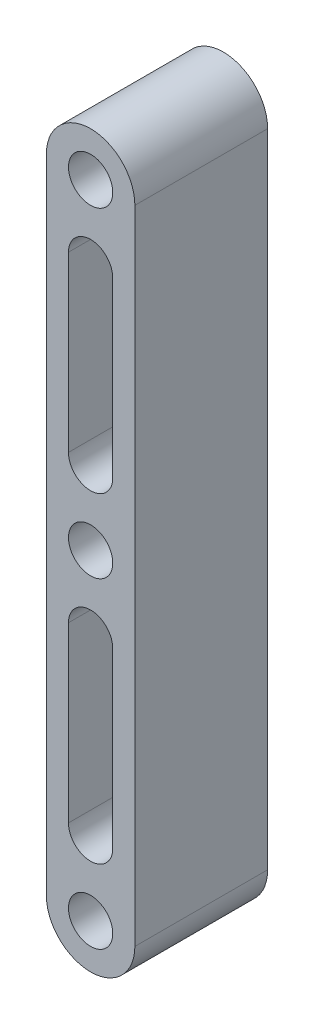
from build123d import *

# Parameters (mm, degrees)
SKETCH1_R           = 3
BOSS_EXTRUDE1_DEPTH = 9


with BuildPart() as part:
    # Sketch1 → Boss-Extrude1 (new, symmetric)
    with BuildSketch(Plane.XY):
        with BuildLine():
            Line((6, 0), (6, -87))
            ThreePointArc((6, -87), (0, -93), (-6, -87))
            Line((-6, -87), (-6, 0))
            ThreePointArc((-6, 0), (0, 6), (6, 0))
        make_face()
        with Locations((0, -87)):
            Circle(SKETCH1_R, mode=Mode.SUBTRACT)
        Circle(SKETCH1_R, mode=Mode.SUBTRACT)
        with Locations((0, -43.5)):
            Circle(SKETCH1_R, mode=Mode.SUBTRACT)
        with BuildLine():
            Line((3, -10), (3, -33.5))
            ThreePointArc((3, -33.5), (0, -36.5), (-3, -33.5))
            Line((-3, -33.5), (-3, -10))
            ThreePointArc((-3, -10), (0, -7), (3, -10))
        make_face(mode=Mode.SUBTRACT)
        with BuildLine():
            Line((3, -53.5), (3, -77))
            ThreePointArc((3, -77), (0, -80), (-3, -77))
            Line((-3, -77), (-3, -53.5))
            ThreePointArc((-3, -53.5), (0, -50.5), (3, -53.5))
        make_face(mode=Mode.SUBTRACT)
    extrude(amount=BOSS_EXTRUDE1_DEPTH, both=True)


solid = part.part
